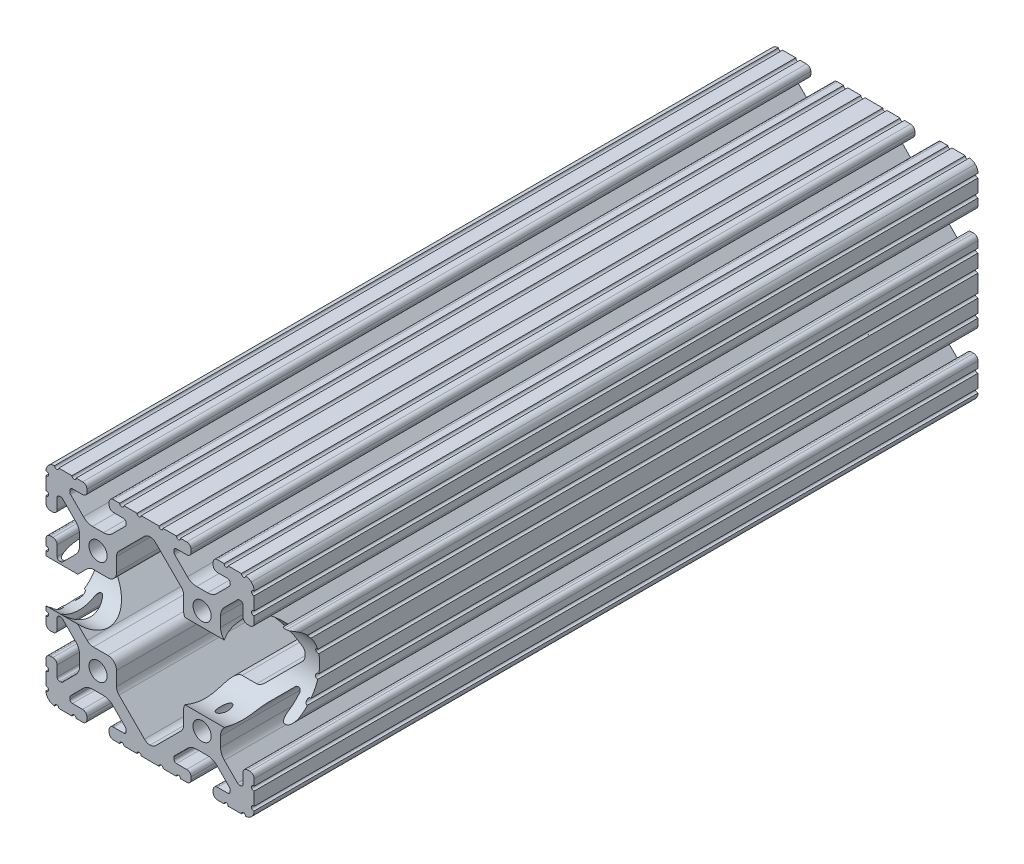
from build123d import *

# Parameters (mm, degrees)
BOSS_EXTRUDE1_DEPTH      = 132.5
BOSS_EXTRUDE1_DEPTH_BACK = 132.5
SKETCH3_R                = 3.3274
SKETCH4_R                = 11.25
CUT_EXTRUDE1_DEPTH       = 158.525563002
SKETCH5_R                = 16
CUT_EXTRUDE4_DEPTH       = 30


with BuildPart() as part:
    # Sketch3 → Boss-Extrude1 (new, two sides: drawn at the far end of the back side and taken through both)
    with BuildSketch(Plane.XY.offset(-BOSS_EXTRUDE1_DEPTH_BACK)):
        with BuildLine():
            Line((34.036, 28.448), (34.036, 24.630196049))
            ThreePointArc((34.036, 24.630196049), (34.497248241, 23.51664429), (35.6108, 23.055396049))
            Line((35.6108, 23.055396049), (36.525200183, 23.055396049))
            ThreePointArc((36.525200183, 23.055396049), (37.638751813, 23.516644236), (38.1, 24.630195866))
            Line((38.1, 24.630195866), (38.1, 27.023826138))
            ThreePointArc((38.1, 27.023826138), (37.117780706, 27.7845421), (38.1, 28.545258062))
            Line((38.1, 28.545258062), (38.1, 33.373016026))
            ThreePointArc((38.1, 33.373016026), (37.141472621, 34.109236774), (38.1, 34.845457521))
            ThreePointArc((38.1, 34.845457521), (37.837757813, 36.120195002), (37.086123144, 37.182631793))
            ThreePointArc((37.086123144, 37.182631793), (36.106286572, 37.843374398), (34.952681874, 38.1))
            ThreePointArc((34.952681874, 38.1), (34.190730434, 37.320215335), (33.428778994, 38.1))
            Line((33.428778994, 38.1), (28.601105935, 38.1))
            ThreePointArc((28.601105935, 38.1), (27.839158581, 37.32021942), (27.077211227, 38.1))
            Line((27.077211227, 38.1), (24.6888, 38.1))
            ThreePointArc((24.6888, 38.1), (23.575248241, 37.638751759), (23.114, 36.5252))
            Line((23.114, 36.5252), (23.114, 35.6108))
            ThreePointArc((23.114, 35.6108), (23.575248241, 34.497248241), (24.6888, 34.036))
            Line((24.6888, 34.036), (28.448, 34.036))
            ThreePointArc((28.448, 34.036), (29.076617928, 33.775617928), (29.337, 33.147))
            Line((29.337, 33.147), (29.337, 32.720693454))
            ThreePointArc((29.337, 32.720693454), (29.326675076, 32.273872751), (29.100231244, 31.888543625))
            Line((29.100231244, 31.888543625), (24.409287499, 27.197588341))
            ThreePointArc((24.409287499, 27.197588341), (22.868340045, 26.167958114), (21.050667579, 25.8064))
            Line((21.050667579, 25.8064), (17.049332421, 25.8064))
            ThreePointArc((17.049332421, 25.8064), (15.231659955, 26.167958114), (13.690712501, 27.197588341))
            Line((13.690712501, 27.197588341), (9.023381298, 31.864931024))
            ThreePointArc((9.023381298, 31.864931024), (8.830670886, 32.153343113), (8.763, 32.493548179))
            Line((8.763, 32.493548179), (8.763, 33.147))
            ThreePointArc((8.763, 33.147), (9.023382072, 33.775617928), (9.652, 34.036))
            Line((9.652, 34.036), (13.4112, 34.036))
            ThreePointArc((13.4112, 34.036), (14.524751759, 34.497248241), (14.986, 35.6108))
            Line((14.986, 35.6108), (14.986, 36.5252))
            ThreePointArc((14.986, 36.5252), (14.524751759, 37.638751759), (13.4112, 38.1))
            Line((13.4112, 38.1), (11.128867074, 38.1))
            ThreePointArc((11.128867074, 38.1), (10.367071033, 37.320370693), (9.605274992, 38.1))
            Line((9.605274992, 38.1), (4.777313069, 38.1))
            ThreePointArc((4.777313069, 38.1), (4.015517029, 37.320370693), (3.253720988, 38.1))
            Line((3.253720988, 38.1), (-3.253720988, 38.1))
            ThreePointArc((-3.253720988, 38.1), (-4.015517029, 37.320370693), (-4.777313069, 38.1))
            Line((-4.777313069, 38.1), (-9.605274992, 38.1))
            ThreePointArc((-9.605274992, 38.1), (-10.367071033, 37.320370693), (-11.128867074, 38.1))
            Line((-11.128867074, 38.1), (-13.4112, 38.1))
            ThreePointArc((-13.4112, 38.1), (-14.524751759, 37.638751759), (-14.986, 36.5252))
            Line((-14.986, 36.5252), (-14.986, 35.6108))
            ThreePointArc((-14.986, 35.6108), (-14.524751759, 34.497248241), (-13.4112, 34.036))
            Line((-13.4112, 34.036), (-9.652, 34.036))
            ThreePointArc((-9.652, 34.036), (-9.023382072, 33.775617928), (-8.763, 33.147))
            Line((-8.763, 33.147), (-8.763, 32.493548179))
            ThreePointArc((-8.763, 32.493548179), (-8.830670886, 32.153343113), (-9.023381298, 31.864931024))
            Line((-9.023381298, 31.864931024), (-13.690712501, 27.197588341))
            ThreePointArc((-13.690712501, 27.197588341), (-15.231659955, 26.167958114), (-17.049332421, 25.8064))
            Line((-17.049332421, 25.8064), (-21.050667579, 25.8064))
            ThreePointArc((-21.050667579, 25.8064), (-22.868340045, 26.167958114), (-24.409287499, 27.197588341))
            Line((-24.409287499, 27.197588341), (-29.100231244, 31.888543625))
            ThreePointArc((-29.100231244, 31.888543625), (-29.326675076, 32.273872751), (-29.337, 32.720693454))
            Line((-29.337, 32.720693454), (-29.337, 33.147))
            ThreePointArc((-29.337, 33.147), (-29.076617928, 33.775617928), (-28.448, 34.036))
            Line((-28.448, 34.036), (-24.6888, 34.036))
            ThreePointArc((-24.6888, 34.036), (-23.575248241, 34.497248241), (-23.114, 35.6108))
            Line((-23.114, 35.6108), (-23.114, 36.5252))
            ThreePointArc((-23.114, 36.5252), (-23.575248241, 37.638751759), (-24.6888, 38.1))
            Line((-24.6888, 38.1), (-27.077211227, 38.1))
            ThreePointArc((-27.077211227, 38.1), (-27.839158581, 37.32021942), (-28.601105935, 38.1))
            Line((-28.601105935, 38.1), (-33.428778994, 38.1))
            ThreePointArc((-33.428778994, 38.1), (-34.190730434, 37.320215335), (-34.952681874, 38.1))
            ThreePointArc((-34.952681874, 38.1), (-36.106286572, 37.843374398), (-37.086123144, 37.182631793))
            ThreePointArc((-37.086123144, 37.182631793), (-37.837757813, 36.120195002), (-38.1, 34.845457521))
            ThreePointArc((-38.1, 34.845457521), (-37.141472621, 34.109236774), (-38.1, 33.373016026))
            Line((-38.1, 33.373016026), (-38.1, 28.545258062))
            ThreePointArc((-38.1, 28.545258062), (-37.117780706, 27.7845421), (-38.1, 27.023826138))
            Line((-38.1, 27.023826138), (-38.1, 24.630195866))
            ThreePointArc((-38.1, 24.630195866), (-37.638751813, 23.516644236), (-36.525200183, 23.055396049))
            Line((-36.525200183, 23.055396049), (-35.6108, 23.055396049))
            ThreePointArc((-35.6108, 23.055396049), (-34.497248241, 23.51664429), (-34.036, 24.630196049))
            Line((-34.036, 24.630196049), (-34.036, 28.448))
            ThreePointArc((-34.036, 28.448), (-33.775617928, 29.076617928), (-33.147, 29.337))
            Line((-33.147, 29.337), (-32.664287242, 29.337))
            ThreePointArc((-32.664287242, 29.337), (-32.324081166, 29.269328695), (-32.03566854, 29.076617155))
            Line((-32.03566854, 29.076617155), (-27.19758008, 24.238516795))
            ThreePointArc((-27.19758008, 24.238516795), (-26.167955879, 22.697572205), (-25.8064, 20.879905136))
            Line((-25.8064, 20.879905136), (-25.8064, 17.220094864))
            ThreePointArc((-25.8064, 17.220094864), (-26.167955879, 15.402427795), (-27.19758008, 13.861483205))
            Line((-27.19758008, 13.861483205), (-31.948944541, 9.110107057))
            ThreePointArc((-31.948944541, 9.110107057), (-32.333417096, 8.853210196), (-32.786933649, 8.763))
            Line((-32.786933649, 8.763), (-33.060275787, 8.763))
            ThreePointArc((-33.060275787, 8.763), (-33.750216995, 9.048783005), (-34.036, 9.738724213))
            Line((-34.036, 9.738724213), (-34.036, 13.469803585))
            ThreePointArc((-34.036, 13.469803585), (-34.497248348, 14.583355603), (-35.610800366, 15.044603951))
            Line((-35.610800366, 15.044603951), (-36.5252, 15.044603951))
            ThreePointArc((-36.5252, 15.044603951), (-37.638751759, 14.58335571), (-38.1, 13.469803951))
            Line((-38.1, 13.469803951), (-38.1, 11.075039289))
            ThreePointArc((-38.1, 11.075039289), (-37.117000248, 10.313517272), (-38.1, 9.551995255))
            Line((-38.1, 9.551995255), (-38.1, 4.723759308))
            ThreePointArc((-38.1, 4.723759308), (-37.117000248, 3.962237292), (-38.1, 3.200715275))
            Line((-38.1, 3.200715275), (-38.1, -3.200715275))
            ThreePointArc((-38.1, -3.200715275), (-37.117000248, -3.962237292), (-38.1, -4.723759308))
            Line((-38.1, -4.723759308), (-38.1, -9.551995255))
            ThreePointArc((-38.1, -9.551995255), (-37.117000248, -10.313517272), (-38.1, -11.075039289))
            Line((-38.1, -11.075039289), (-38.1, -13.469803951))
            ThreePointArc((-38.1, -13.469803951), (-37.638751759, -14.58335571), (-36.5252, -15.044603951))
            Line((-36.5252, -15.044603951), (-35.610800366, -15.044603951))
            ThreePointArc((-35.610800366, -15.044603951), (-34.497248348, -14.583355603), (-34.036, -13.469803585))
            Line((-34.036, -13.469803585), (-34.036, -9.738724213))
            ThreePointArc((-34.036, -9.738724213), (-33.750216995, -9.048783005), (-33.060275787, -8.763))
            Line((-33.060275787, -8.763), (-32.786933649, -8.763))
            ThreePointArc((-32.786933649, -8.763), (-32.333417096, -8.853210196), (-31.948944541, -9.110107057))
            Line((-31.948944541, -9.110107057), (-27.19758008, -13.861483205))
            ThreePointArc((-27.19758008, -13.861483205), (-26.167955879, -15.402427795), (-25.8064, -17.220094864))
            Line((-25.8064, -17.220094864), (-25.8064, -20.879905136))
            ThreePointArc((-25.8064, -20.879905136), (-26.167955879, -22.697572205), (-27.19758008, -24.238516795))
            Line((-27.19758008, -24.238516795), (-32.03566854, -29.076617155))
            ThreePointArc((-32.03566854, -29.076617155), (-32.324081166, -29.269328695), (-32.664287242, -29.337))
            Line((-32.664287242, -29.337), (-33.147, -29.337))
            ThreePointArc((-33.147, -29.337), (-33.775617928, -29.076617928), (-34.036, -28.448))
            Line((-34.036, -28.448), (-34.036, -24.630196049))
            ThreePointArc((-34.036, -24.630196049), (-34.497248241, -23.51664429), (-35.6108, -23.055396049))
            Line((-35.6108, -23.055396049), (-36.525200183, -23.055396049))
            ThreePointArc((-36.525200183, -23.055396049), (-37.638751813, -23.516644236), (-38.1, -24.630195866))
            Line((-38.1, -24.630195866), (-38.1, -27.023826138))
            ThreePointArc((-38.1, -27.023826138), (-37.117780706, -27.7845421), (-38.1, -28.545258062))
            Line((-38.1, -28.545258062), (-38.1, -33.373016026))
            ThreePointArc((-38.1, -33.373016026), (-37.141472621, -34.109236774), (-38.1, -34.845457521))
            ThreePointArc((-38.1, -34.845457521), (-37.837757813, -36.120195002), (-37.086123144, -37.182631793))
            ThreePointArc((-37.086123144, -37.182631793), (-36.106286572, -37.843374398), (-34.952681874, -38.1))
            ThreePointArc((-34.952681874, -38.1), (-34.190730434, -37.320215335), (-33.428778994, -38.1))
            Line((-33.428778994, -38.1), (-28.601105935, -38.1))
            ThreePointArc((-28.601105935, -38.1), (-27.839158581, -37.32021942), (-27.077211227, -38.1))
            Line((-27.077211227, -38.1), (-24.6888, -38.1))
            ThreePointArc((-24.6888, -38.1), (-23.575248241, -37.638751759), (-23.114, -36.5252))
            Line((-23.114, -36.5252), (-23.114, -35.6108))
            ThreePointArc((-23.114, -35.6108), (-23.575248241, -34.497248241), (-24.6888, -34.036))
            Line((-24.6888, -34.036), (-28.448, -34.036))
            ThreePointArc((-28.448, -34.036), (-29.076617928, -33.775617928), (-29.337, -33.147))
            Line((-29.337, -33.147), (-29.337, -32.720693454))
            ThreePointArc((-29.337, -32.720693454), (-29.326675076, -32.273872751), (-29.100231244, -31.888543625))
            Line((-29.100231244, -31.888543625), (-24.409287499, -27.197588341))
            ThreePointArc((-24.409287499, -27.197588341), (-22.868340045, -26.167958114), (-21.050667579, -25.8064))
            Line((-21.050667579, -25.8064), (-17.049332421, -25.8064))
            ThreePointArc((-17.049332421, -25.8064), (-15.231659955, -26.167958114), (-13.690712501, -27.197588341))
            Line((-13.690712501, -27.197588341), (-9.023381298, -31.864931024))
            ThreePointArc((-9.023381298, -31.864931024), (-8.830670886, -32.153343113), (-8.763, -32.493548179))
            Line((-8.763, -32.493548179), (-8.763, -33.147))
            ThreePointArc((-8.763, -33.147), (-9.023382072, -33.775617928), (-9.652, -34.036))
            Line((-9.652, -34.036), (-13.4112, -34.036))
            ThreePointArc((-13.4112, -34.036), (-14.524751759, -34.497248241), (-14.986, -35.6108))
            Line((-14.986, -35.6108), (-14.986, -36.5252))
            ThreePointArc((-14.986, -36.5252), (-14.524751759, -37.638751759), (-13.4112, -38.1))
            Line((-13.4112, -38.1), (-11.128867074, -38.1))
            ThreePointArc((-11.128867074, -38.1), (-10.367071033, -37.320370693), (-9.605274992, -38.1))
            Line((-9.605274992, -38.1), (-4.777313069, -38.1))
            ThreePointArc((-4.777313069, -38.1), (-4.015517029, -37.320370693), (-3.253720988, -38.1))
            Line((-3.253720988, -38.1), (3.253720988, -38.1))
            ThreePointArc((3.253720988, -38.1), (4.015517029, -37.320370693), (4.777313069, -38.1))
            Line((4.777313069, -38.1), (9.605274992, -38.1))
            ThreePointArc((9.605274992, -38.1), (10.367071033, -37.320370693), (11.128867074, -38.1))
            Line((11.128867074, -38.1), (13.4112, -38.1))
            ThreePointArc((13.4112, -38.1), (14.524751759, -37.638751759), (14.986, -36.5252))
            Line((14.986, -36.5252), (14.986, -35.6108))
            ThreePointArc((14.986, -35.6108), (14.524751759, -34.497248241), (13.4112, -34.036))
            Line((13.4112, -34.036), (9.652, -34.036))
            ThreePointArc((9.652, -34.036), (9.023382072, -33.775617928), (8.763, -33.147))
            Line((8.763, -33.147), (8.763, -32.493548179))
            ThreePointArc((8.763, -32.493548179), (8.830670886, -32.153343113), (9.023381298, -31.864931024))
            Line((9.023381298, -31.864931024), (13.690712501, -27.197588341))
            ThreePointArc((13.690712501, -27.197588341), (15.231659955, -26.167958114), (17.049332421, -25.8064))
            Line((17.049332421, -25.8064), (21.050667579, -25.8064))
            ThreePointArc((21.050667579, -25.8064), (22.868340045, -26.167958114), (24.409287499, -27.197588341))
            Line((24.409287499, -27.197588341), (29.100231244, -31.888543625))
            ThreePointArc((29.100231244, -31.888543625), (29.326675076, -32.273872751), (29.337, -32.720693454))
            Line((29.337, -32.720693454), (29.337, -33.147))
            ThreePointArc((29.337, -33.147), (29.076617928, -33.775617928), (28.448, -34.036))
            Line((28.448, -34.036), (24.6888, -34.036))
            ThreePointArc((24.6888, -34.036), (23.575248241, -34.497248241), (23.114, -35.6108))
            Line((23.114, -35.6108), (23.114, -36.5252))
            ThreePointArc((23.114, -36.5252), (23.575248241, -37.638751759), (24.6888, -38.1))
            Line((24.6888, -38.1), (27.077211227, -38.1))
            ThreePointArc((27.077211227, -38.1), (27.839158581, -37.32021942), (28.601105935, -38.1))
            Line((28.601105935, -38.1), (33.428778994, -38.1))
            ThreePointArc((33.428778994, -38.1), (34.190730434, -37.320215335), (34.952681874, -38.1))
            ThreePointArc((34.952681874, -38.1), (36.106286572, -37.843374398), (37.086123144, -37.182631793))
            ThreePointArc((37.086123144, -37.182631793), (37.837757813, -36.120195002), (38.1, -34.845457521))
            ThreePointArc((38.1, -34.845457521), (37.141472621, -34.109236774), (38.1, -33.373016026))
            Line((38.1, -33.373016026), (38.1, -28.545258062))
            ThreePointArc((38.1, -28.545258062), (37.117780706, -27.7845421), (38.1, -27.023826138))
            Line((38.1, -27.023826138), (38.1, -24.630195866))
            ThreePointArc((38.1, -24.630195866), (37.638751813, -23.516644236), (36.525200183, -23.055396049))
            Line((36.525200183, -23.055396049), (35.6108, -23.055396049))
            ThreePointArc((35.6108, -23.055396049), (34.497248241, -23.51664429), (34.036, -24.630196049))
            Line((34.036, -24.630196049), (34.036, -28.448))
            ThreePointArc((34.036, -28.448), (33.775617928, -29.076617928), (33.147, -29.337))
            Line((33.147, -29.337), (32.664287242, -29.337))
            ThreePointArc((32.664287242, -29.337), (32.324081166, -29.269328695), (32.03566854, -29.076617155))
            Line((32.03566854, -29.076617155), (27.19758008, -24.238516795))
            ThreePointArc((27.19758008, -24.238516795), (26.167955879, -22.697572205), (25.8064, -20.879905136))
            Line((25.8064, -20.879905136), (25.8064, -17.220094864))
            ThreePointArc((25.8064, -17.220094864), (26.167955879, -15.402427795), (27.19758008, -13.861483205))
            Line((27.19758008, -13.861483205), (31.948944541, -9.110107057))
            ThreePointArc((31.948944541, -9.110107057), (32.333417096, -8.853210196), (32.786933649, -8.763))
            Line((32.786933649, -8.763), (33.060275787, -8.763))
            ThreePointArc((33.060275787, -8.763), (33.750216995, -9.048783005), (34.036, -9.738724213))
            Line((34.036, -9.738724213), (34.036, -13.469803585))
            ThreePointArc((34.036, -13.469803585), (34.497248348, -14.583355603), (35.610800366, -15.044603951))
            Line((35.610800366, -15.044603951), (36.5252, -15.044603951))
            ThreePointArc((36.5252, -15.044603951), (37.638751759, -14.58335571), (38.1, -13.469803951))
            Line((38.1, -13.469803951), (38.1, -11.075039289))
            ThreePointArc((38.1, -11.075039289), (37.117000248, -10.313517272), (38.1, -9.551995255))
            Line((38.1, -9.551995255), (38.1, -4.723759308))
            ThreePointArc((38.1, -4.723759308), (37.117000248, -3.962237292), (38.1, -3.200715275))
            Line((38.1, -3.200715275), (38.1, 3.200715275))
            ThreePointArc((38.1, 3.200715275), (37.117000248, 3.962237292), (38.1, 4.723759308))
            Line((38.1, 4.723759308), (38.1, 9.551995255))
            ThreePointArc((38.1, 9.551995255), (37.117000248, 10.313517272), (38.1, 11.075039289))
            Line((38.1, 11.075039289), (38.1, 13.469803951))
            ThreePointArc((38.1, 13.469803951), (37.638751759, 14.58335571), (36.5252, 15.044603951))
            Line((36.5252, 15.044603951), (35.610800366, 15.044603951))
            ThreePointArc((35.610800366, 15.044603951), (34.497248348, 14.583355603), (34.036, 13.469803585))
            Line((34.036, 13.469803585), (34.036, 9.738724213))
            ThreePointArc((34.036, 9.738724213), (33.750216995, 9.048783005), (33.060275787, 8.763))
            Line((33.060275787, 8.763), (32.786933649, 8.763))
            ThreePointArc((32.786933649, 8.763), (32.333417096, 8.853210196), (31.948944541, 9.110107057))
            Line((31.948944541, 9.110107057), (27.19758008, 13.861483205))
            ThreePointArc((27.19758008, 13.861483205), (26.167955879, 15.402427795), (25.8064, 17.220094864))
            Line((25.8064, 17.220094864), (25.8064, 20.879905136))
            ThreePointArc((25.8064, 20.879905136), (26.167955879, 22.697572205), (27.19758008, 24.238516795))
            Line((27.19758008, 24.238516795), (32.03566854, 29.076617155))
            ThreePointArc((32.03566854, 29.076617155), (32.324081166, 29.269328695), (32.664287242, 29.337))
            Line((32.664287242, 29.337), (33.147, 29.337))
            ThreePointArc((33.147, 29.337), (33.775617928, 29.076617928), (34.036, 28.448))
        make_face()
        with Locations((19.05, 19.05)):
            Circle(SKETCH3_R, mode=Mode.SUBTRACT)
        with Locations((-19.05, 19.05)):
            Circle(SKETCH3_R, mode=Mode.SUBTRACT)
        with Locations((19.05, -19.05)):
            Circle(SKETCH3_R, mode=Mode.SUBTRACT)
        with Locations((-19.05, -19.05)):
            Circle(SKETCH3_R, mode=Mode.SUBTRACT)
        with BuildLine():
            Line((-11.363666791, -22.843321003), (-2.051515952, -32.155494748))
            ThreePointArc((-2.051515952, -32.155494748), (-1.11031328, -32.786013752), (0, -33.011005091))
            ThreePointArc((0, -33.011005091), (1.11031328, -32.786013752), (2.051515952, -32.155494748))
            Line((2.051515952, -32.155494748), (11.363666791, -22.843321003))
            ThreePointArc((11.363666791, -22.843321003), (12.051918263, -21.813277828), (12.2936, -20.598259734))
            Line((12.2936, -20.598259734), (12.2936, -15.4686))
            ThreePointArc((12.2936, -15.4686), (13.22353597, -13.22353597), (15.4686, -12.2936))
            Line((15.4686, -12.2936), (20.769026744, -12.2936))
            ThreePointArc((20.769026744, -12.2936), (21.984048446, -12.051916769), (23.014093535, -11.363661269))
            Line((23.014093535, -11.363661269), (31.902125566, -2.475607377))
            ThreePointArc((31.902125566, -2.475607377), (32.607298578, -1.335259481), (32.728725173, 0))
            ThreePointArc((32.728725173, 0), (32.607298578, 1.335259481), (31.902125566, 2.475607377))
            Line((31.902125566, 2.475607377), (23.014093535, 11.363661269))
            ThreePointArc((23.014093535, 11.363661269), (21.984048446, 12.051916769), (20.769026744, 12.2936))
            Line((20.769026744, 12.2936), (15.4686, 12.2936))
            ThreePointArc((15.4686, 12.2936), (13.22353597, 13.22353597), (12.2936, 15.4686))
            Line((12.2936, 15.4686), (12.2936, 20.598259734))
            ThreePointArc((12.2936, 20.598259734), (12.051918263, 21.813277828), (11.363666791, 22.843321003))
            Line((11.363666791, 22.843321003), (2.051515952, 32.155494748))
            ThreePointArc((2.051515952, 32.155494748), (1.11031328, 32.786013752), (0, 33.011005091))
            ThreePointArc((0, 33.011005091), (-1.11031328, 32.786013752), (-2.051515952, 32.155494748))
            Line((-2.051515952, 32.155494748), (-11.363666791, 22.843321003))
            ThreePointArc((-11.363666791, 22.843321003), (-12.051918263, 21.813277828), (-12.2936, 20.598259734))
            Line((-12.2936, 20.598259734), (-12.2936, 15.4686))
            ThreePointArc((-12.2936, 15.4686), (-13.22353597, 13.22353597), (-15.4686, 12.2936))
            Line((-15.4686, 12.2936), (-20.769026744, 12.2936))
            ThreePointArc((-20.769026744, 12.2936), (-21.984048446, 12.051916769), (-23.014093535, 11.363661269))
            Line((-23.014093535, 11.363661269), (-31.902125566, 2.475607377))
            ThreePointArc((-31.902125566, 2.475607377), (-32.607298578, 1.335259481), (-32.728725173, 0))
            ThreePointArc((-32.728725173, 0), (-32.607298578, -1.335259481), (-31.902125566, -2.475607377))
            Line((-31.902125566, -2.475607377), (-23.014093535, -11.363661269))
            ThreePointArc((-23.014093535, -11.363661269), (-21.984048446, -12.051916769), (-20.769026744, -12.2936))
            Line((-20.769026744, -12.2936), (-15.4686, -12.2936))
            ThreePointArc((-15.4686, -12.2936), (-13.22353597, -13.22353597), (-12.2936, -15.4686))
            Line((-12.2936, -15.4686), (-12.2936, -20.598259734))
            ThreePointArc((-12.2936, -20.598259734), (-12.051918263, -21.813277828), (-11.363666791, -22.843321003))
        make_face(mode=Mode.SUBTRACT)
    extrude(amount=BOSS_EXTRUDE1_DEPTH + BOSS_EXTRUDE1_DEPTH_BACK)

    # Sketch4 → Cut-Extrude1 (cut, through all)
    with BuildSketch(Plane(origin=(38.1, 0, 0), x_dir=(0, 0, -1), z_dir=(1, 0, 0))):
        with Locations((-124.5, 0)):
            Circle(SKETCH4_R)
    extrude(amount=-CUT_EXTRUDE1_DEPTH, mode=Mode.SUBTRACT)

    # Sketch5 → Cut-Extrude4 (cut)
    with BuildSketch(Plane(origin=(38.1, 0, 0), x_dir=(0, 0, -1), z_dir=(1, 0, 0))):
        with Locations((-124.5, 0)):
            Circle(SKETCH5_R)
    extrude(amount=-CUT_EXTRUDE4_DEPTH, mode=Mode.SUBTRACT)


with BuildPart() as cut_extrude4_kept_piece:
    # of the separate pieces the step leaves, the one the design keeps (cut_extrude4_pieces_kept)
    add(part.part.solids().sort_by_distance((38.1, -33.373016026, 132.5))[0])


solid = cut_extrude4_kept_piece.part
